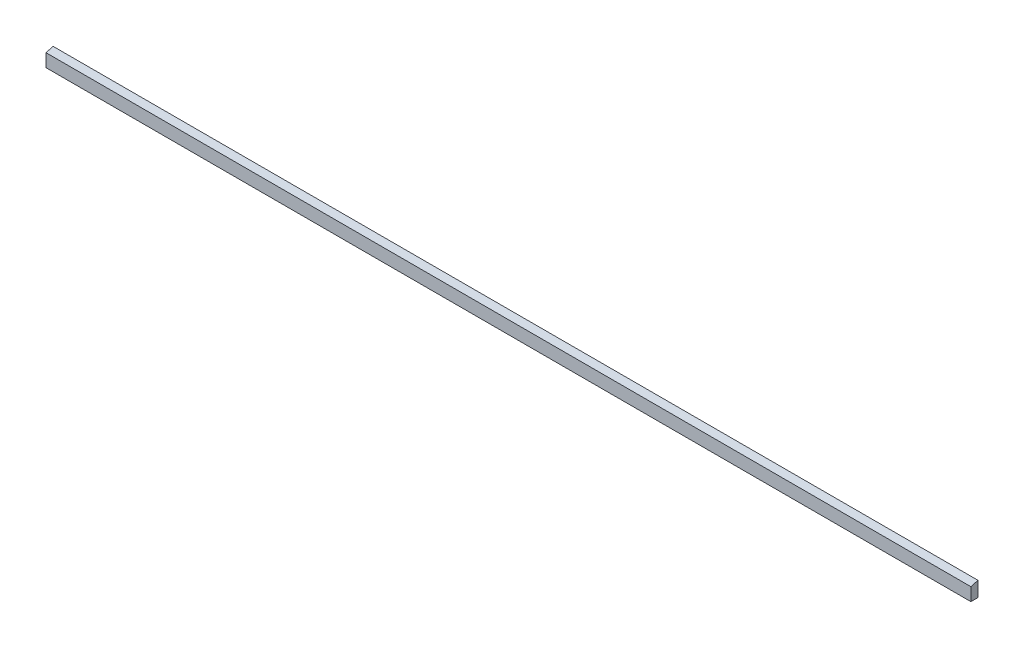
from build123d import *

# Parameters (mm, degrees)
BOSS_EXTRUDE1_DEPTH = 2362.2


with BuildPart() as part:
    # Sketch1 → Boss-Extrude1 (new body)
    with BuildSketch(Plane(origin=(0, 0, 0), x_dir=(0, 0, -1), z_dir=(1, 0, 0))):
        Polygon((0, 0), (-18.25625, 0), (-18.25625, 33.208252556), (0, 38.1), align=None)
    extrude(amount=BOSS_EXTRUDE1_DEPTH)


solid = part.part
